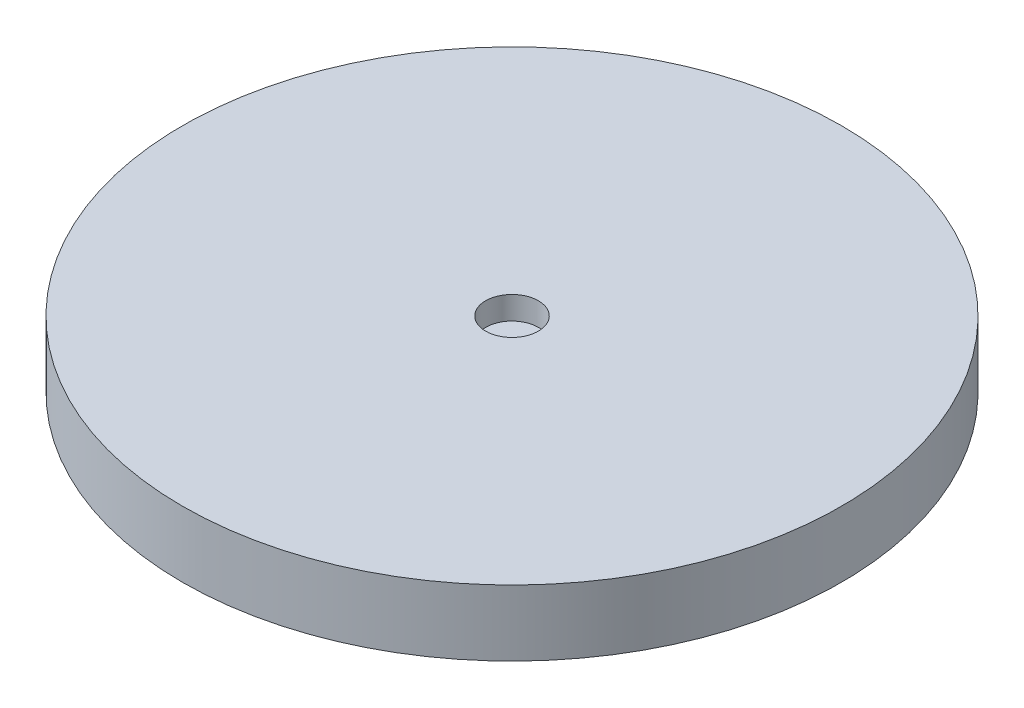
from build123d import *

# Parameters (mm, degrees)
SKETCH1_R           = 50
BOSS_EXTRUDE1_DEPTH = 10
SKETCH2_R           = 4
CUT_EXTRUDE1_DEPTH  = 3.5


with BuildPart() as part:
    # Sketch1 → Boss-Extrude1 (new body)
    with BuildSketch(Plane(origin=(0, 0, 0), x_dir=(1, 0, 0), z_dir=(0, 1, 0))):
        with Locations(Location((0, 0, 0), (0, 0, 270))):
            Circle(SKETCH1_R)
    extrude(amount=BOSS_EXTRUDE1_DEPTH)

    # Sketch2 → Cut-Extrude1 (cut)
    with BuildSketch(Plane(origin=(0, 10, 0), x_dir=(1, 0, 0), z_dir=(0, 1, 0))):
        with Locations(Location((0, 0, 0), (0, 0, 270))):
            Circle(SKETCH2_R)
    extrude(amount=-CUT_EXTRUDE1_DEPTH, mode=Mode.SUBTRACT)


solid = part.part
